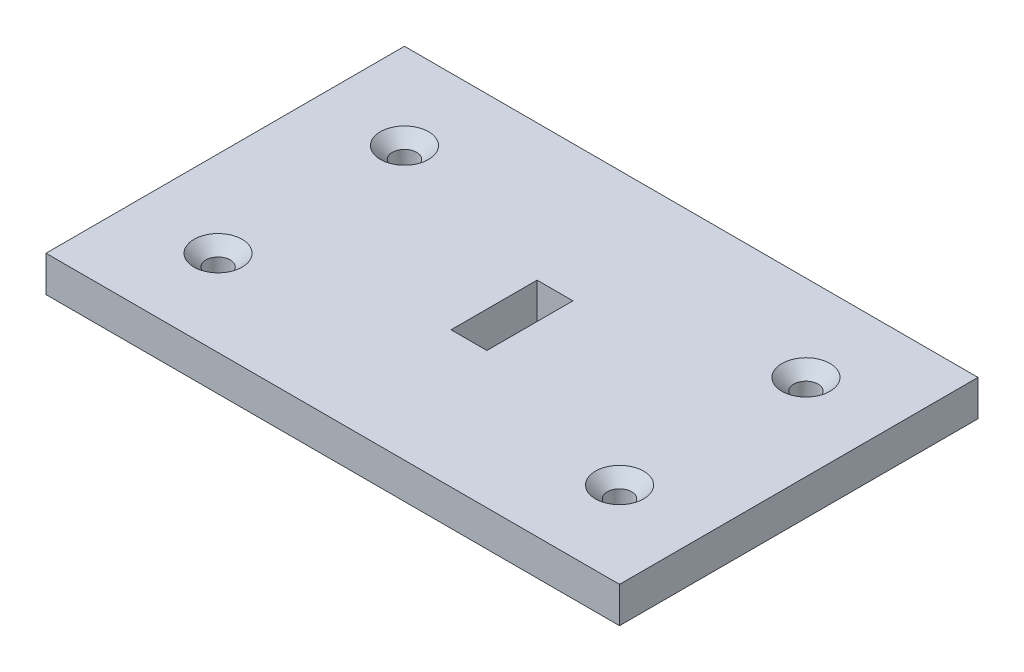
from build123d import *

# Parameters (mm, degrees)
SKETCH1_W                                            = 80
SKETCH1_H                                            = 50
BOSS_EXTRUDE1_DEPTH                                  = 2.5
SKETCH2_W                                            = 5
SKETCH2_H                                            = 12
CUT_EXTRUDE1_DEPTH                                   = 5
CSK_FOR_M3_HEX_SOCKET_COUNTERSUNK_CAP_SC_D           = 3.4
CSK_FOR_M3_HEX_SOCKET_COUNTERSUNK_CAP_SC_CSINK_D     = 6.72
CSK_FOR_M3_HEX_SOCKET_COUNTERSUNK_CAP_SC_CSINK_ANGLE = 90


with BuildPart() as part:
    # Sketch1 → Boss-Extrude1 (new, symmetric)
    with BuildSketch(Plane(origin=(0, 0, 0), x_dir=(1, 0, 0), z_dir=(0, 1, 0))):
        Rectangle(SKETCH1_W, SKETCH1_H)
    extrude(amount=BOSS_EXTRUDE1_DEPTH, both=True)

    # Sketch2 → Cut-Extrude1 (cut)
    with BuildSketch(Plane(origin=(0, 2.5, 0), x_dir=(1, 0, 0), z_dir=(0, 1, 0))):
        Rectangle(SKETCH2_W, SKETCH2_H)
    extrude(amount=-CUT_EXTRUDE1_DEPTH, mode=Mode.SUBTRACT)

    # CSK for M3 Hex Socket Countersunk Cap Screw1 (through all)
    with Locations(Plane(origin=(0, 2.5, 0), x_dir=(1, 0, 0), z_dir=(0, 1, 0))):
        with Locations((28, -13), (28, 13), (-28, -13), (-28, 13)):
            CounterSinkHole(CSK_FOR_M3_HEX_SOCKET_COUNTERSUNK_CAP_SC_D / 2, CSK_FOR_M3_HEX_SOCKET_COUNTERSUNK_CAP_SC_CSINK_D / 2, counter_sink_angle=CSK_FOR_M3_HEX_SOCKET_COUNTERSUNK_CAP_SC_CSINK_ANGLE)


solid = part.part
